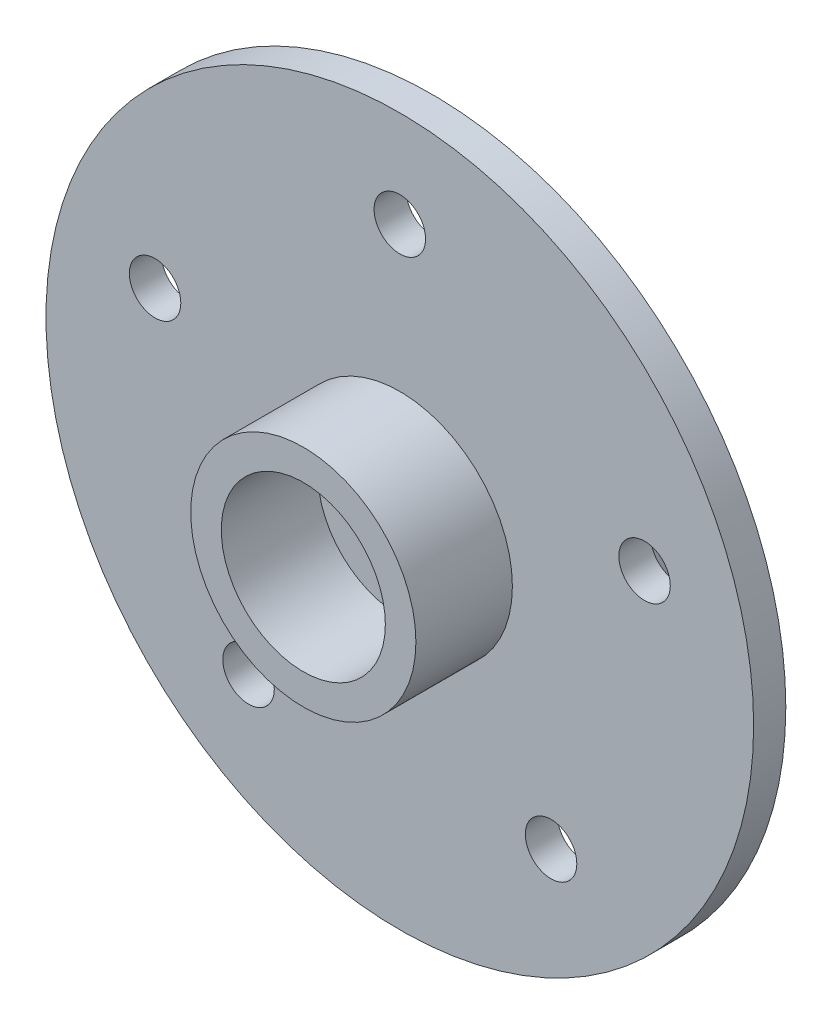
from build123d import *

# Parameters (mm, degrees)
SKETCH_1_R      = 22
SKETCH_1_R_2    = 3.1
SKETCH_1_R_3    = 1.6
EXTRUDE_1_DEPTH = 2
SKETCH_3_R      = 11
SKETCH_3_R_2    = 7.6
EXTRUDE_2_DEPTH = 5
SKETCH_2_R      = 7
SKETCH_2_R_2    = 5.1
EXTRUDE_3_DEPTH = 6


with BuildPart() as part:
    # 草图1 → 凸台-拉伸1 (new body)
    with BuildSketch(Plane.XY):
        Circle(SKETCH_1_R)
        Circle(SKETCH_1_R_2, mode=Mode.SUBTRACT)
        with Locations((0, 16)):
            Circle(SKETCH_1_R_3, mode=Mode.SUBTRACT)
        with Locations((15.216904261, 4.94427191)):
            Circle(SKETCH_1_R_3, mode=Mode.SUBTRACT)
        with Locations((9.404564037, -12.94427191)):
            Circle(SKETCH_1_R_3, mode=Mode.SUBTRACT)
        with Locations((-9.404564037, -12.94427191)):
            Circle(SKETCH_1_R_3, mode=Mode.SUBTRACT)
        with Locations((-15.216904261, 4.94427191)):
            Circle(SKETCH_1_R_3, mode=Mode.SUBTRACT)
    extrude(amount=EXTRUDE_1_DEPTH)

    # 草图3 → 凸台-拉伸2 (add)
    with BuildSketch(Plane(origin=(0, 0, 0), x_dir=(-1, 0, 0), z_dir=(0, 0, -1))):
        with Locations(Location((0, 0, 0), (0, 0, 180))):
            Circle(SKETCH_3_R)
        Circle(SKETCH_3_R_2, mode=Mode.SUBTRACT)
    extrude(amount=EXTRUDE_2_DEPTH)

    # 草图2 → 凸台-拉伸3 (add)
    with BuildSketch(Plane.XY.offset(2)):
        Circle(SKETCH_2_R)
        Circle(SKETCH_2_R_2, mode=Mode.SUBTRACT)
    extrude(amount=EXTRUDE_3_DEPTH)


solid = part.part
